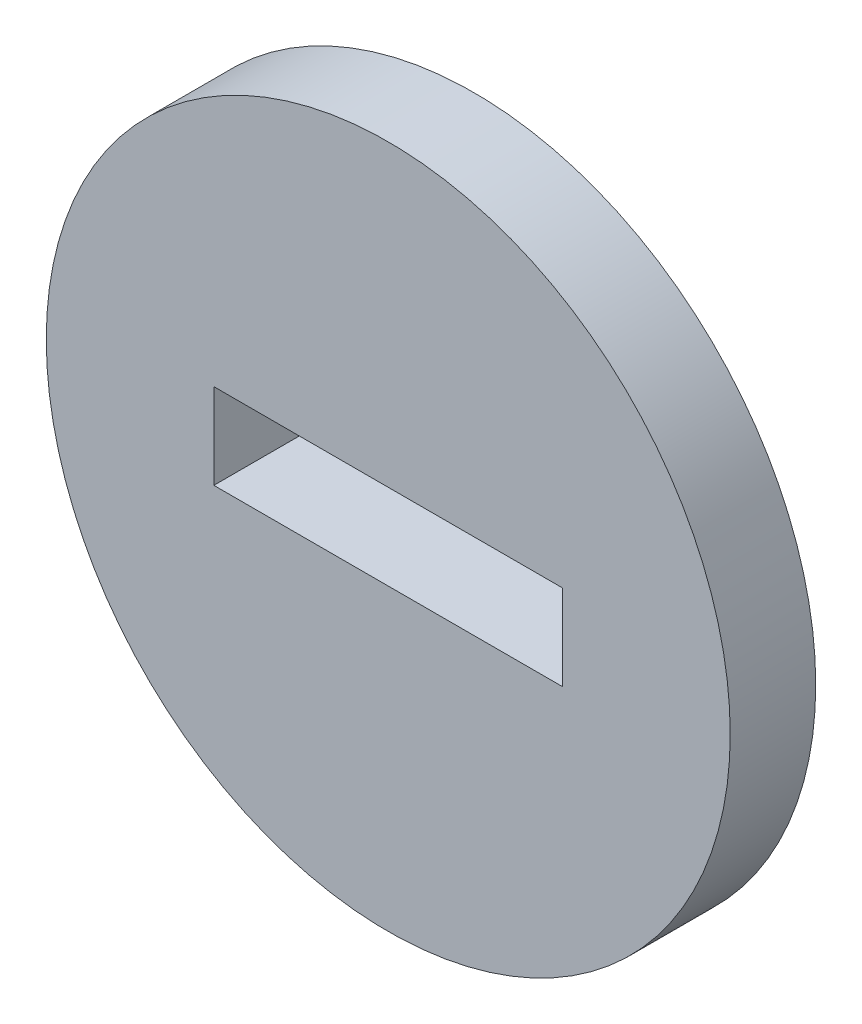
from build123d import *

# Parameters (mm, degrees)
SKETCH1_R           = 10
SKETCH1_W           = 10.2
SKETCH1_H           = 2.5
BOSS_EXTRUDE1_DEPTH = 2.5


with BuildPart() as part:
    # Sketch1 → Boss-Extrude1 (new body)
    with BuildSketch(Plane.XY):
        Circle(SKETCH1_R)
        Rectangle(SKETCH1_W, SKETCH1_H, mode=Mode.SUBTRACT)
    extrude(amount=BOSS_EXTRUDE1_DEPTH)


solid = part.part
